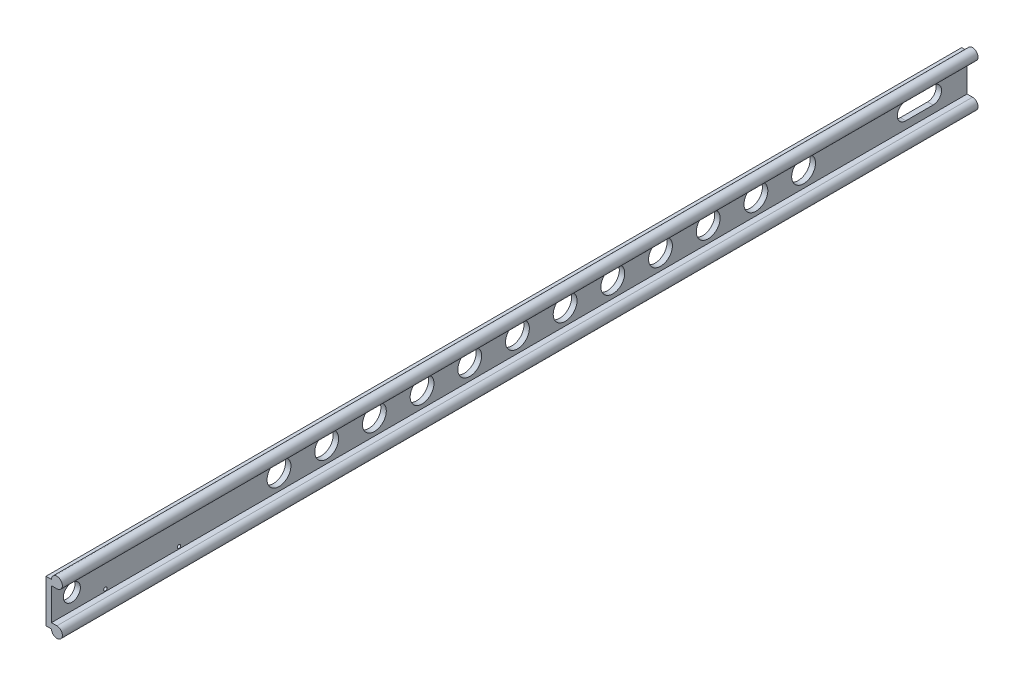
from build123d import *

# Parameters (mm, degrees)
BOSS_EXTRUDE1_DEPTH = 853.44
SKETCH2_R           = 11.1125
CUT_EXTRUDE1_DEPTH  = 25.4
LPATTERN1_COUNT     = 12
LPATTERN1_PITCH     = 44.45
SKETCH3_R           = 7.9375
CUT_EXTRUDE2_DEPTH  = 25.4
SKETCH5_R           = 1.5875
CUT_EXTRUDE3_DEPTH  = 12.7


with BuildPart() as part:
    # Sketch1 → Boss-Extrude1 (new body)
    with BuildSketch(Plane.XY):
        with BuildLine():
            Line((-13.154409933, 15.906683314), (-8.074409933, 15.906683314))
            ThreePointArc((-8.074409933, 15.906683314), (0.597692516, 19.498785762), (-2.994409933, 10.826683314))
            Line((-2.994409933, 10.826683314), (-8.074409933, 10.826683314))
            Line((-8.074409933, 10.826683314), (-8.074409933, -19.018316686))
            Line((-8.074409933, -19.018316686), (-2.994409933, -19.018316686))
            ThreePointArc((-2.994409933, -19.018316686), (0.597692516, -27.690419135), (-8.074409933, -24.098316686))
            Line((-8.074409933, -24.098316686), (-13.154409933, -24.098316686))
            Line((-13.154409933, -24.098316686), (-13.154409933, 15.906683314))
        make_face()
    extrude(amount=BOSS_EXTRUDE1_DEPTH)

    # Sketch2 → Cut-Extrude1 (cut)
    with BuildSketch(Plane.ZY.offset(13.154409933)):
        with Locations(Location((152.4, -4.095816686, 0), (0, 0, 270))):
            Circle(SKETCH2_R)
    cut_extrude1 = extrude(amount=-CUT_EXTRUDE1_DEPTH, mode=Mode.SUBTRACT)

    # LPattern1: Cut-Extrude1 ×12
    with Locations(*[(0, 0, i * LPATTERN1_PITCH) for i in range(1, LPATTERN1_COUNT)]):
        add(cut_extrude1, mode=Mode.SUBTRACT)

    # Sketch3 → Cut-Extrude2 (cut)
    with BuildSketch(Plane.ZY.offset(13.154409933)):
        with Locations(Location((834.39, -4.095816686, 0), (0, 0, 270))):
            Circle(SKETCH3_R)
        with BuildLine():
            Line((31.75, 3.841683314), (57.15, 3.841683314))
            ThreePointArc((57.15, 3.841683314), (65.0875, -4.095816686), (57.15, -12.033316686))
            Line((57.15, -12.033316686), (31.75, -12.033316686))
            ThreePointArc((31.75, -12.033316686), (23.8125, -4.095816686), (31.75, 3.841683314))
        make_face()
    extrude(amount=-CUT_EXTRUDE2_DEPTH, mode=Mode.SUBTRACT)

    # Sketch5 → Cut-Extrude3 (cut)
    with BuildSketch(Plane.ZY.offset(13.154409933)):
        with Locations(Location((734.568, 8.794683314, 0), (0, 0, 270))):
            Circle(SKETCH5_R)
        with Locations(Location((808.228, 8.794683314, 0), (0, 0, 270))):
            Circle(SKETCH5_R)
        with Locations(Location((803.148, -16.986316686, 0), (0, 0, 270))):
            Circle(SKETCH5_R)
        with Locations(Location((734.568, -16.986316686, 0), (0, 0, 270))):
            Circle(SKETCH5_R)
    extrude(amount=-CUT_EXTRUDE3_DEPTH, mode=Mode.SUBTRACT)


solid = part.part
